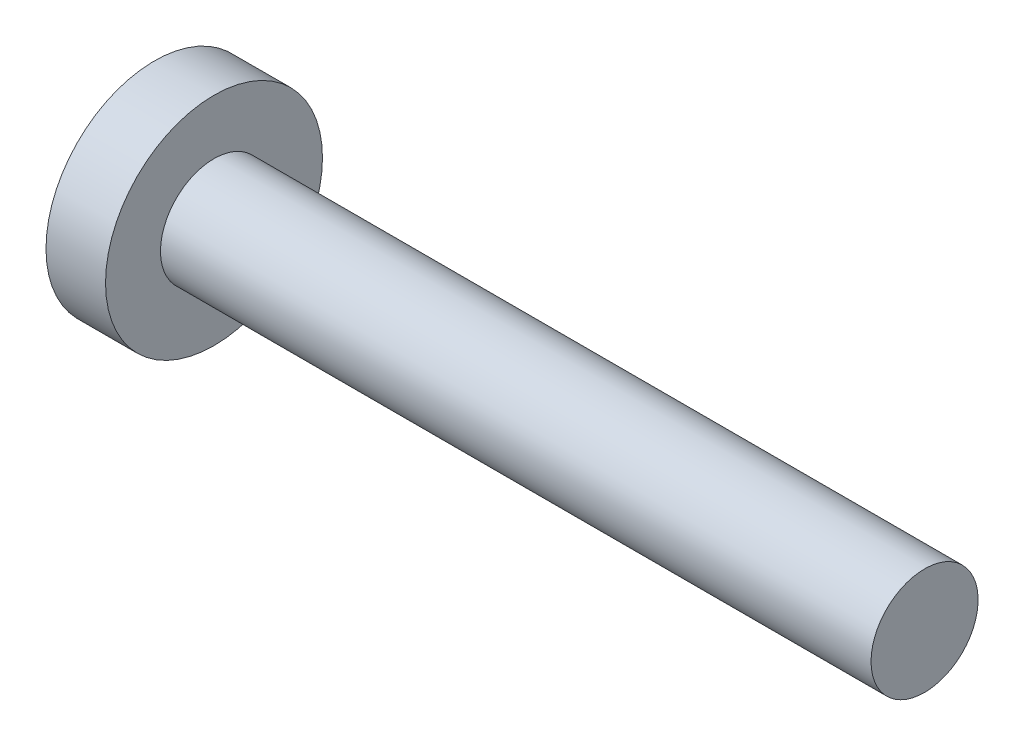
from build123d import *

# Parameters (mm, degrees)
SKETCH2_W         = 6
SKETCH2_H         = 1
SLOT_DEPTH        = 1.5
CIRPATTERN1_COUNT = 2
CIRPATTERN1_ANGLE = 90


with BuildPart() as part:
    # BodySke → Base-Revolve (revolve)
    with BuildSketch(Plane.XY, mode=Mode.PRIVATE) as base_revolve_sk:
        with BuildLine():
            Line((0, 0), (30.016891186, 0))
            Line((30.016891186, 0), (30.016891186, 2))
            Line((30.016891186, 2), (3.470777776, 2))
            Line((3.470777776, 2), (3.470777776, 4.052285877))
            Line((3.470777776, 4.052285877), (1.246697171, 4.052285877))
            ThreePointArc((1.246697171, 4.052285877), (0.326924477, 2.117338651), (0, 0))
        make_face()
    revolve(base_revolve_sk.sketch.rotate(Axis((-15.875, 0, 0), (1, 0, 0)), 90), axis=Axis((-15.875, 0, 0), (1, 0, 0)))

    # Sketch2 → Slot (cut)
    with BuildSketch(Plane(origin=(0, 0, 0), x_dir=(0, 0, -1), z_dir=(1, 0, 0))):
        Rectangle(SKETCH2_W, SKETCH2_H)
    extrude(amount=SLOT_DEPTH, mode=Mode.SUBTRACT)

    # Sketch3 → Cross section 0
    with BuildSketch(Plane(origin=(0, 0, 0), x_dir=(0, 0, -1), z_dir=(1, 0, 0))):
        with BuildLine():
            Line((0.415, -1.72), (-0.415, -1.72))
            Line((-0.415, -1.72), (-0.415, 1.72))
            Line((-0.415, 1.72), (0.415, 1.72))
            Line((0.415, 1.72), (0.415, -1.72))
        make_face()
    # Sketch4 → Cross section 1
    with BuildSketch(Plane(origin=(2.33, 0, 0), x_dir=(0, 0, -1), z_dir=(1, 0, 0))):
        with BuildLine():
            Line((0.2075, -0.2075), (-0.2075, -0.2075))
            Line((-0.2075, -0.2075), (-0.2075, 0.2075))
            Line((-0.2075, 0.2075), (0.2075, 0.2075))
            Line((0.2075, 0.2075), (0.2075, -0.2075))
        make_face()
    cross = loft(mode=Mode.SUBTRACT)

    # CirPattern1: Cross ×2 about axis
    cirpattern1_axis = Axis((0, 0, 0), (1, 0, 0))
    for i in range(1, CIRPATTERN1_COUNT):
        add(cross.rotate(cirpattern1_axis, i * CIRPATTERN1_ANGLE / (CIRPATTERN1_COUNT - 1)), mode=Mode.SUBTRACT)


solid = part.part
